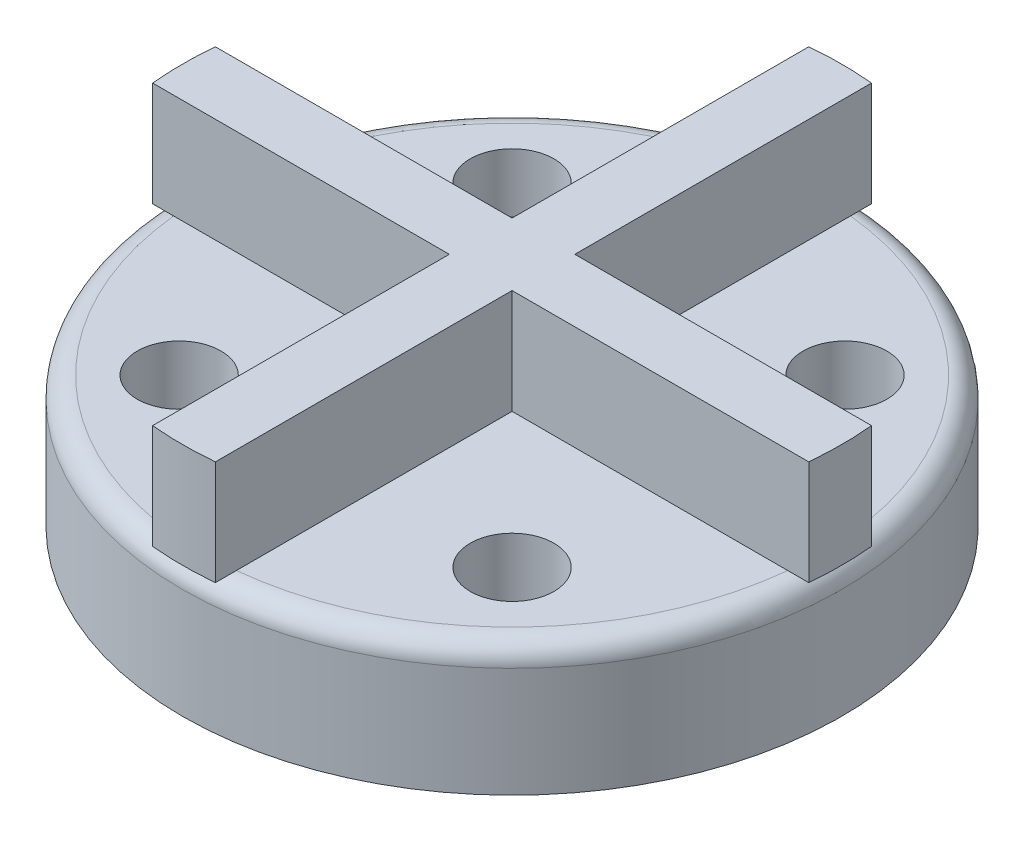
from build123d import *

# Parameters (mm, degrees)
SKETCH_1_R      = 31.5
SKETCH_1_R_2    = 4
EXTRUDE_1_DEPTH = 12.5
FILLET_1_R      = 2
EXTRUDE_2_DEPTH = 10


with BuildPart() as part:
    # 草图1 → 凸台-拉伸1 (new body)
    with BuildSketch(Plane(origin=(0, 0, 0), x_dir=(1, 0, 0), z_dir=(0, 1, 0))):
        with Locations(Location((0, 0, 0), (0, 0, 270))):
            Circle(SKETCH_1_R)
        with Locations(Location((-15.909902577, 15.909902577, 0), (0, 0, 270))):
            Circle(SKETCH_1_R_2, mode=Mode.SUBTRACT)
        with Locations(Location((15.909902577, 15.909902577, 0), (0, 0, 270))):
            Circle(SKETCH_1_R_2, mode=Mode.SUBTRACT)
        with Locations(Location((15.909902577, -15.909902577, 0), (0, 0, 270))):
            Circle(SKETCH_1_R_2, mode=Mode.SUBTRACT)
        with Locations(Location((-15.909902577, -15.909902577, 0), (0, 0, 270))):
            Circle(SKETCH_1_R_2, mode=Mode.SUBTRACT)
    extrude(amount=EXTRUDE_1_DEPTH)

    # 圆角1
    fillet_1_edges = [part.edges().sort_by_distance(p)[0] for p in [
        (0, 12.5, -31.5),
    ]]
    fillet(fillet_1_edges, radius=FILLET_1_R)

    # 草图2 → 凸台-拉伸2 (add)
    with BuildSketch(Plane(origin=(0, 12.5, 0), x_dir=(1, 0, 0), z_dir=(0, 1, 0))):
        with BuildLine():
            Line((3, 31.356817441), (3, 3))
            Line((3, 3), (31.356817441, 3))
            ThreePointArc((31.356817441, 3), (31.5, 0), (31.356817441, -3))
            Line((31.356817441, -3), (3, -3))
            Line((3, -3), (3, -31.356817441))
            ThreePointArc((3, -31.356817441), (0, -31.5), (-3, -31.356817441))
            Line((-3, -31.356817441), (-3, -3))
            Line((-3, -3), (-31.356817441, -3))
            ThreePointArc((-31.356817441, -3), (-31.5, 0), (-31.356817441, 3))
            Line((-31.356817441, 3), (-3, 3))
            Line((-3, 3), (-3, 31.356817441))
            ThreePointArc((-3, 31.356817441), (0, 31.5), (3, 31.356817441))
        make_face()
    extrude(amount=EXTRUDE_2_DEPTH)


solid = part.part
